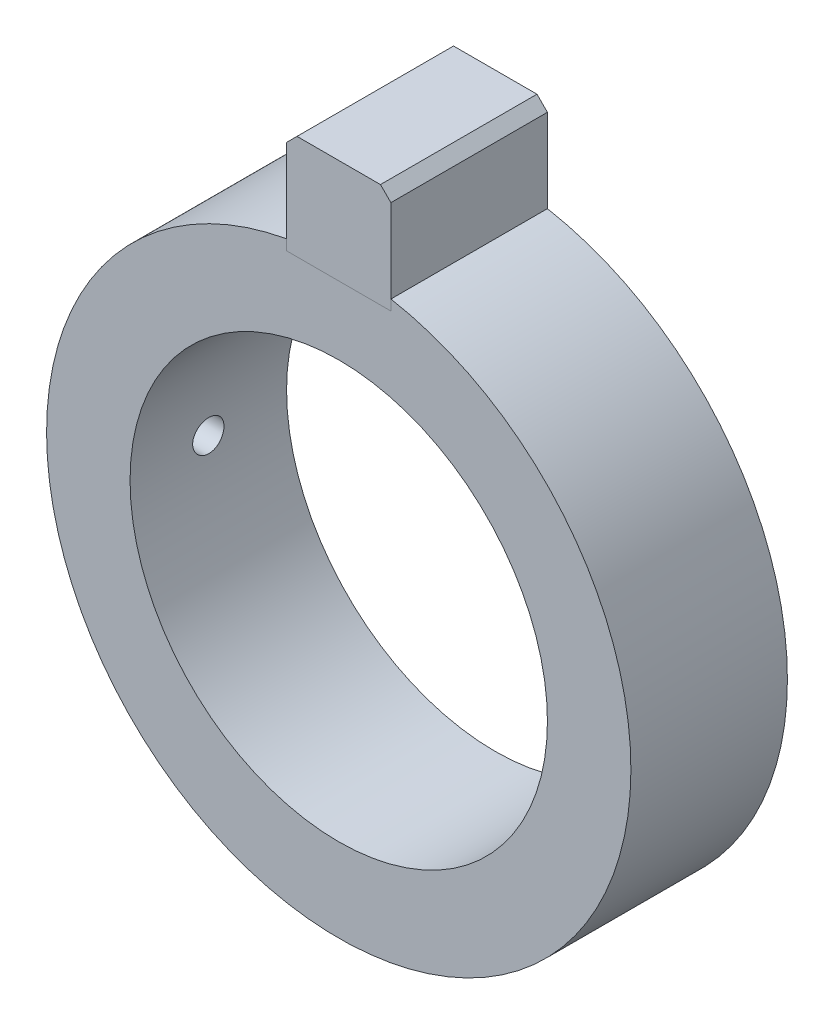
from build123d import *

# Parameters (mm, degrees)
SKETCH1_R               = 28
SKETCH1_R_2             = 20
BOSS_EXTRUDE1_DEPTH     = 15
CUT_EXTRUDE1_REACH      = 66.382
CUT_EXTRUDE1_END_RADIUS = 20
SKETCH2_R               = 1.5
SKETCH3_W               = 5
SKETCH3_H               = 1
CUT_EXTRUDE2_DEPTH      = 15
SKETCH5_W               = 10
SKETCH5_H               = 15
BOSS_EXTRUDE2_DEPTH     = 10
CUT_EXTRUDE3_DEPTH      = 15


with BuildPart() as part:
    # Sketch1 → Boss-Extrude1 (new body)
    with BuildSketch(Plane.XY):
        Circle(SKETCH1_R)
        Circle(SKETCH1_R_2, mode=Mode.SUBTRACT)
    extrude(amount=BOSS_EXTRUDE1_DEPTH)

    # Cut-Extrude1: up to this cylinder (the profile starts outside it)
    cut_extrude1_end = Plane(origin=(0, 0, 7.5), z_dir=(0, 0, -1)) * Cylinder(CUT_EXTRUDE1_END_RADIUS, 173.764, mode=Mode.PRIVATE)
    # Sketch2 → Cut-Extrude1 (cut, up to the surface)
    with BuildSketch(Plane.ZY.offset(28), mode=Mode.PRIVATE) as cut_extrude1_sk1:
        with Locations((7.5, 0)):
            Circle(SKETCH2_R)
    cut_extrude1_tool1 = extrude(cut_extrude1_sk1.sketch, amount=-CUT_EXTRUDE1_REACH, mode=Mode.PRIVATE) - cut_extrude1_end
    add(cut_extrude1_tool1.solids().sort_by_distance((-28, 0, 7.5))[0], mode=Mode.SUBTRACT)

    # Sketch3 → Cut-Extrude2 (cut)
    with BuildSketch(Plane(origin=(0, 0, 0), x_dir=(-1, 0, 0), z_dir=(0, 0, -1))):
        with BuildLine():
            Line((-5, 27.549954628), (0, 27.549954628))
            Line((0, 27.549954628), (0, 28))
            ThreePointArc((0, 28), (-2.510106613, 27.887261694), (-5, 27.549954628))
        make_face()
        with BuildLine():
            Line((0, 28), (0, 27.549954628))
            Line((0, 27.549954628), (5, 27.549954628))
            ThreePointArc((5, 27.549954628), (2.510106613, 27.887261694), (0, 28))
        make_face()
        with Locations((-2.5, 27.049954628)):
            Rectangle(SKETCH3_W, SKETCH3_H)
        with Locations((2.5, 27.049954628)):
            Rectangle(SKETCH3_W, SKETCH3_H)
    extrude(amount=-CUT_EXTRUDE2_DEPTH, mode=Mode.SUBTRACT)


with BuildPart() as body_2:
    # Sketch5 → Boss-Extrude2 (new body)
    with BuildSketch(Plane(origin=(0, 26.549954628, 0), x_dir=(1, 0, 0), z_dir=(0, 1, 0))):
        with Locations((0, -7.5)):
            Rectangle(SKETCH5_W, SKETCH5_H)
    extrude(amount=BOSS_EXTRUDE2_DEPTH)

    # Sketch6 → Cut-Extrude3 (cut)
    with BuildSketch(Plane(origin=(0, 0, 0), x_dir=(-1, 0, 0), z_dir=(0, 0, -1))):
        Polygon((-5, 36.549954628), (-5, 35.549954628), (-4, 36.549954628), align=None)
        Polygon((5, 36.549954628), (4, 36.549954628), (5, 35.549954628), align=None)
    extrude(amount=-CUT_EXTRUDE3_DEPTH, mode=Mode.SUBTRACT)


solid = Compound([part.part, body_2.part])
